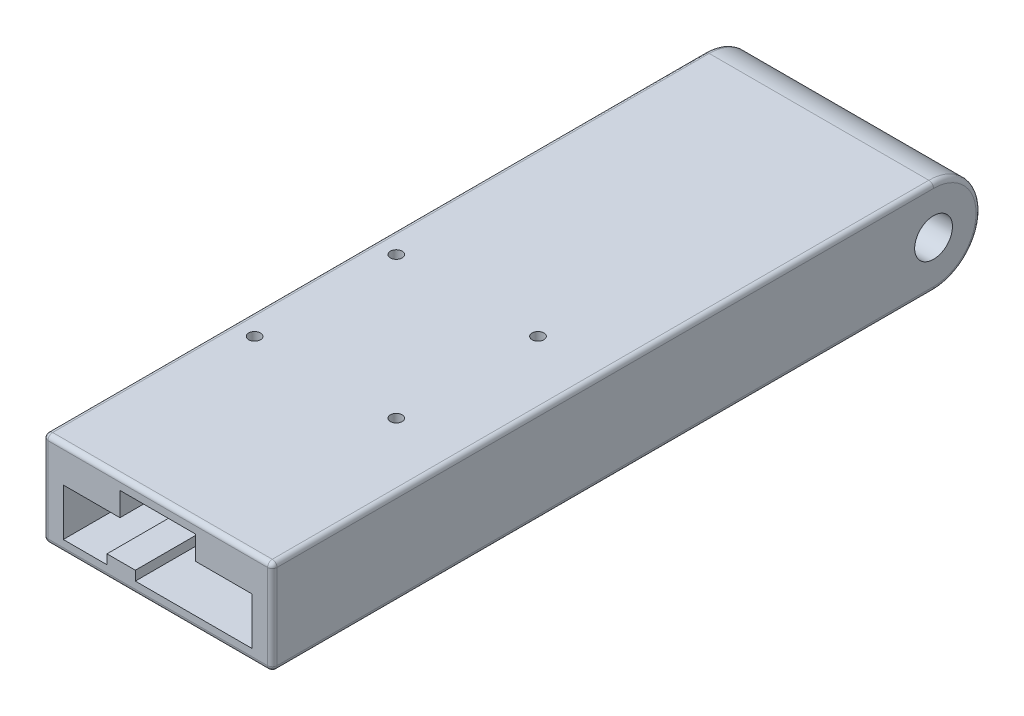
from build123d import *

# Parameters (mm, degrees)
SKETCH_1_W               = 48.5
SKETCH_1_H               = 150
EXTRUDE_1_DEPTH          = 20
CUT_EXTRUDE_1_REACH      = 93.527
CUT_EXTRUDE_2_REACH      = 93.527
SKETCH_4_R               = 4
M3X0_5_1_D               = 2.5
M3X0_5_1_DEPTH           = 7.5
M3X0_5_1_TIP             = 0.751075774
CUT_EXTRUDE_3_DEPTH      = 14
CUT_EXTRUDE_4_DEPTH      = 1
CUT_EXTRUDE_4_DEPTH_BACK = 6
CUT_EXTRUDE_5_DEPTH      = 120
FILLET_1_R               = 1


with BuildPart() as part:
    # 草图1 → 凸台-拉伸1 (new body)
    with BuildSketch(Plane(origin=(0, 0, 0), x_dir=(1, 0, 0), z_dir=(0, 1, 0))):
        Rectangle(SKETCH_1_W, SKETCH_1_H)
    extrude(amount=EXTRUDE_1_DEPTH)

    # 草图3 → 切除-拉伸1 (cut, up to next)
    with BuildSketch(Plane(origin=(24.25, 0, 0), x_dir=(0, 0, -1), z_dir=(1, 0, 0)), mode=Mode.PRIVATE) as cut_extrude_1_sk1:
        with BuildLine():
            Line((75, 0), (75, 10))
            ThreePointArc((75, 10), (72.071067812, 2.928932188), (65, 0))
            Line((65, 0), (75, 0))
        make_face()
    cut_extrude_1_tool1 = extrude(cut_extrude_1_sk1.sketch, amount=-CUT_EXTRUDE_1_REACH, mode=Mode.PRIVATE) & part.part
    # 草图3 → 切除-拉伸1 (cut, up to next)
    with BuildSketch(Plane(origin=(24.25, 0, 0), x_dir=(0, 0, -1), z_dir=(1, 0, 0)), mode=Mode.PRIVATE) as cut_extrude_1_sk2:
        with BuildLine():
            Line((75, 20), (65, 20))
            ThreePointArc((65, 20), (72.071067812, 17.071067812), (75, 10))
            Line((75, 10), (75, 20))
        make_face()
    cut_extrude_1_tool2 = extrude(cut_extrude_1_sk2.sketch, amount=-CUT_EXTRUDE_1_REACH, mode=Mode.PRIVATE) & part.part
    add(cut_extrude_1_tool1.solids().sort_by_distance((24.25, 2.233679, -72.766321))[0], mode=Mode.SUBTRACT)
    add(cut_extrude_1_tool2.solids().sort_by_distance((24.25, 17.766321, -72.766321))[0], mode=Mode.SUBTRACT)

    # 草图4 → 切除-拉伸2 (cut, up to next)
    with BuildSketch(Plane(origin=(24.25, 0, 0), x_dir=(0, 0, -1), z_dir=(1, 0, 0)), mode=Mode.PRIVATE) as cut_extrude_2_sk1:
        with Locations((65, 10)):
            Circle(SKETCH_4_R)
    cut_extrude_2_tool1 = extrude(cut_extrude_2_sk1.sketch, amount=-CUT_EXTRUDE_2_REACH, mode=Mode.PRIVATE) & part.part
    add(cut_extrude_2_tool1.solids().sort_by_distance((24.25, 10, -65))[0], mode=Mode.SUBTRACT)

    # M3x0.5 螺纹孔1
    with Locations(Plane(origin=(-19.5, 20, 5), x_dir=(0, 0, 1), z_dir=(0, 1, 0))):
        with Locations((0, 0), (0, 30), (30, 0), (30, 30)):
            Hole(M3X0_5_1_D / 2, depth=M3X0_5_1_DEPTH)
            with Locations((0, 0, -(M3X0_5_1_DEPTH + M3X0_5_1_TIP / 2))):  # 118° drill point
                Cone(0, M3X0_5_1_D / 2, M3X0_5_1_TIP, mode=Mode.SUBTRACT)

    # 草图9 → 切除-拉伸3 (cut)
    with BuildSketch(Plane.ZY.offset(24.25)):
        with BuildLine():
            Line((24.145780988, 0), (15.854219012, 0))
            ThreePointArc((15.854219012, 0), (20, 2.75), (24.145780988, 0))
        make_face()
    extrude(amount=-CUT_EXTRUDE_3_DEPTH, mode=Mode.SUBTRACT)

    # 草图10 → 切除-拉伸4 (cut, two sides: drawn at the far end of the back side and taken through both)
    with BuildSketch(Plane.ZY.offset(10.25).offset(-CUT_EXTRUDE_4_DEPTH_BACK)):
        with BuildLine():
            Line((28.828221792, 0), (11.171778209, 0))
            ThreePointArc((11.171778209, 0), (20, 7.25), (28.828221792, 0))
        make_face()
    extrude(amount=CUT_EXTRUDE_4_DEPTH + CUT_EXTRUDE_4_DEPTH_BACK, mode=Mode.SUBTRACT)

    # 草图11 → 切除-拉伸5 (cut)
    with BuildSketch(Plane.XY.offset(75)):
        Polygon((-4.7499492, 2.5), (20, 2.5), (20, 12.5), (8, 12.5), (8, 17.5), (-8, 17.5), (-8, 12.5), (-20, 12.5), (-20, 2.5), (-10.7499492, 2.5), (-10.7499492, 4.5), (-4.7499492, 4.5), align=None)
    extrude(amount=-CUT_EXTRUDE_5_DEPTH, mode=Mode.SUBTRACT)

    # 圆角1
    fillet_1_edges = [part.edges().sort_by_distance(p)[0] for p in [
        (-24.25, 0, -24.572890494),
        (0, 20, 75),
        (24.25, 10, -75),
        (-24.25, 10, -75),
        (-24.25, 20, 5),
        (24.25, 20, 5),
        (0, 0, 75),
        (-24.25, 0, 49.572890494),
        (24.25, 0, 5),
        (24.25, 10, 75),
        (-24.25, 10, 75),
    ]]
    fillet(fillet_1_edges, radius=FILLET_1_R)


solid = part.part
